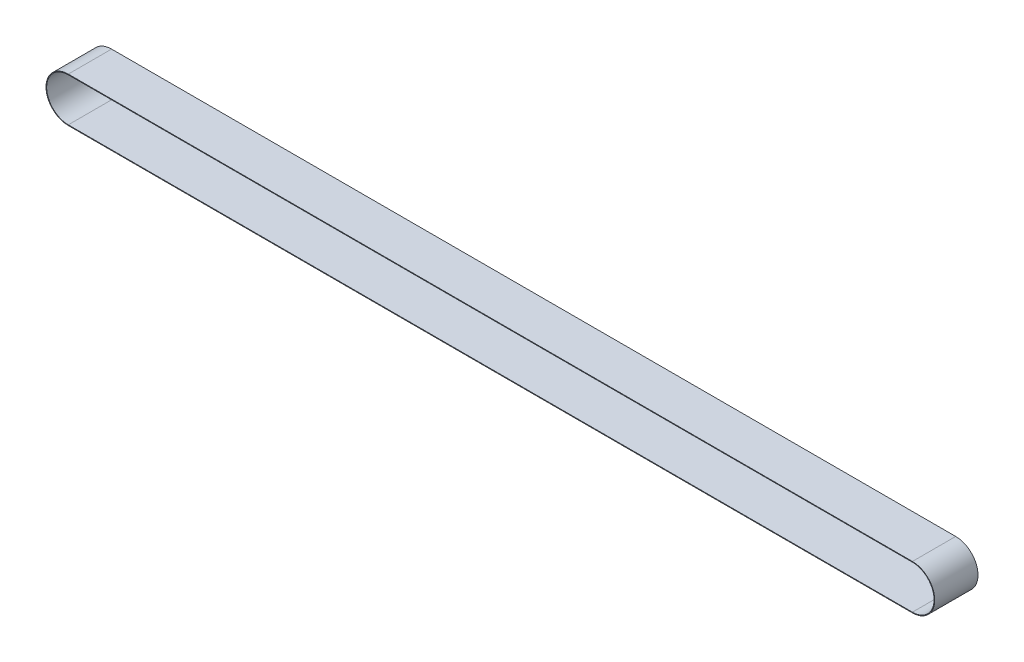
from build123d import *

# Parameters (mm, degrees)
LINEAR_AUSTRAGEN_D_NN1_DEPTH = 100


with BuildPart() as part:
    # Skizze2 → Linear-Austragen-Dünn1 (new, symmetric)
    with BuildSketch(Plane.XY):
        with BuildLine():
            Line((3900, -103), (0, -103))
            ThreePointArc((0, -103), (-103, 0), (0, 103))
            Line((0, 103), (3900, 103))
            ThreePointArc((3900, 103), (4003, 0), (3900, -103))
        make_face()
        with BuildLine():
            Line((3900, -100), (0, -100))
            ThreePointArc((0, -100), (-100, 0), (0, 100))
            Line((0, 100), (3900, 100))
            ThreePointArc((3900, 100), (4000, 0), (3900, -100))
        make_face(mode=Mode.SUBTRACT)
    extrude(amount=LINEAR_AUSTRAGEN_D_NN1_DEPTH, both=True)


solid = part.part
